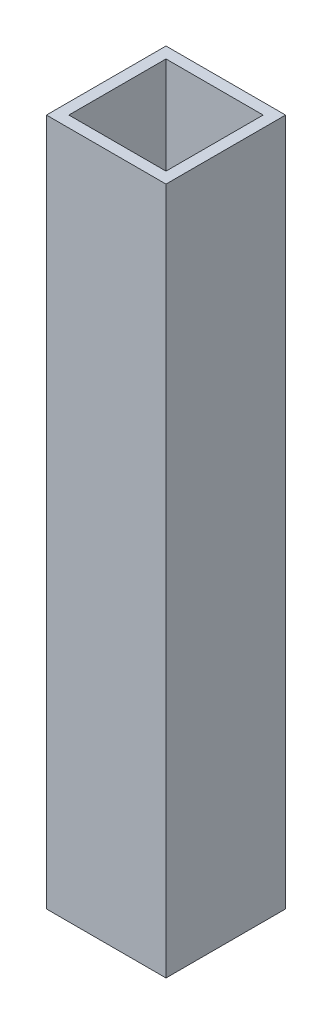
from build123d import *

# Parameters (mm, degrees)
SKETCH1_W           = 50.8
SKETCH1_H           = 292.1
BOSS_EXTRUDE1_DEPTH = 50.8
CUT_EXTRUDE1_REACH  = 299.571
SKETCH3_W           = 41.275
SKETCH3_H           = 41.275


with BuildPart() as part:
    # Sketch1 → Boss-Extrude1 (new body)
    with BuildSketch(Plane.XY):
        Rectangle(SKETCH1_W, SKETCH1_H)
    extrude(amount=BOSS_EXTRUDE1_DEPTH)

    # Sketch3 → Cut-Extrude1 (cut, up to next)
    with BuildSketch(Plane(origin=(0, 146.05, 0), x_dir=(1, 0, 0), z_dir=(0, 1, 0)), mode=Mode.PRIVATE) as cut_extrude1_sk1:
        with Locations((0, -25.4)):
            Rectangle(SKETCH3_W, SKETCH3_H)
    cut_extrude1_tool1 = extrude(cut_extrude1_sk1.sketch, amount=-CUT_EXTRUDE1_REACH, mode=Mode.PRIVATE) & part.part
    add(cut_extrude1_tool1.solids().sort_by_distance((0, 146.05, 25.4))[0], mode=Mode.SUBTRACT)


solid = part.part
